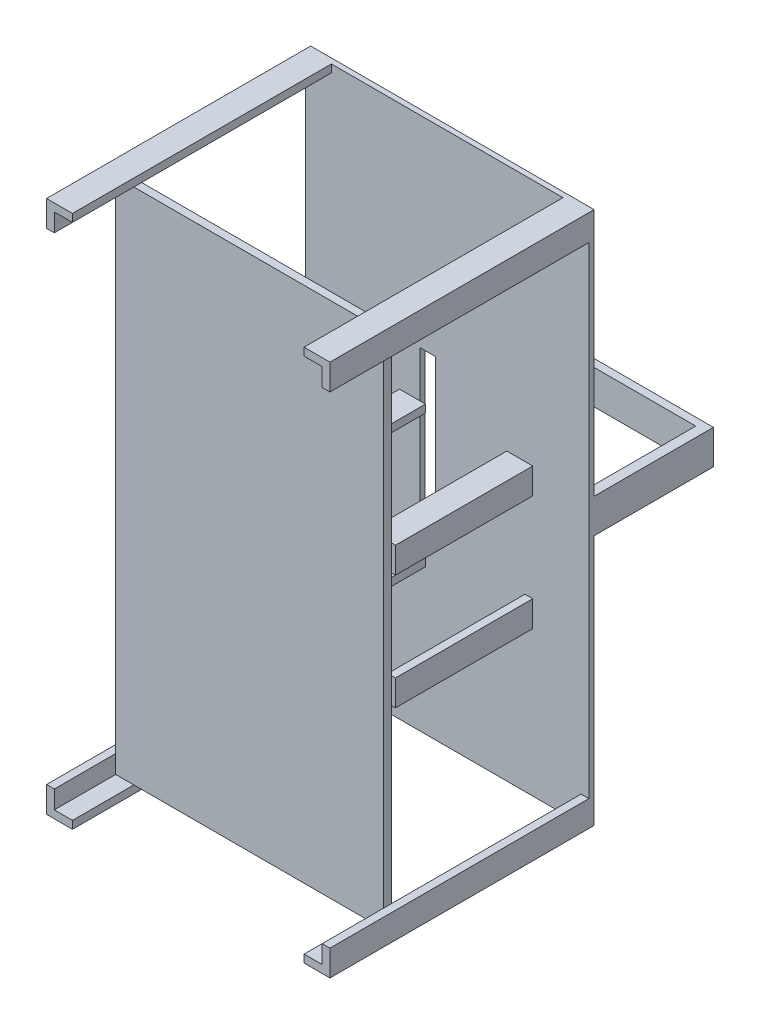
from build123d import *

# Parameters (mm, degrees)
SKETCH1_W             = 1500
SKETCH1_H             = 1500
BOSS_EXTRUDE1_DEPTH   = 20
SKETCH2_W             = 60
SKETCH2_H             = 550
CUT_EXTRUDE1_DEPTH    = 50
CUT_EXTRUDE2_DEPTH    = 2000.909849413
SKETCH4_W             = 1094.415961308
SKETCH4_H             = 600
BOSS_EXTRUDE2_DEPTH   = 20
BOSS_EXTRUDE3_DEPTH   = 1000
SKETCH6_W             = 1034.415961308
SKETCH6_H             = 1999.906293538
BOSS_EXTRUDE4_DEPTH   = 30
BOSS_EXTRUDE5_DEPTH   = 530
BOSS_EXTRUDE5_2_DEPTH = 530
BOSS_EXTRUDE5_3_DEPTH = 530
BOSS_EXTRUDE5_4_DEPTH = 530
SKETCH9_W             = 38.38274209
SKETCH9_H             = 132.105402432
BOSS_EXTRUDE6_DEPTH   = 461
BOSS_EXTRUDE7_DEPTH   = 30
SKETCH11_R            = 22.381871054
BOSS_EXTRUDE8_DEPTH   = 50
BOSS_EXTRUDE8_2_DEPTH = 50
FILLET1_R             = 20
FILLET2_R             = 20


with BuildPart() as part:
    # Sketch1 → Boss-Extrude1 (new body)
    with BuildSketch(Plane.XY):
        with Locations((-647.933366328, 680.042554992)):
            Rectangle(SKETCH1_W, SKETCH1_H)
    extrude(amount=BOSS_EXTRUDE1_DEPTH)

    # Sketch2 → Cut-Extrude1 (cut)
    with BuildSketch(Plane(origin=(0, 0, 0), x_dir=(-1, 0, 0), z_dir=(0, 0, -1))):
        with Locations((926.595771641, 727.237288333)):
            Rectangle(SKETCH2_W, SKETCH2_H)
    extrude(amount=-CUT_EXTRUDE1_DEPTH, mode=Mode.SUBTRACT)

    # Sketch3 → Cut-Extrude2 (cut, through all)
    with BuildSketch(Plane.XY.offset(20)):
        Polygon((-1397.933366328, 1180.031353787), (-303.51740502, 1180.031353787), (-303.51740502, 320.125060249), (-1397.933366328, 320.125060249), (-2007.945142602, 196.828102761), (-1938.57438465, -209.936796138), (-1019.34429441, -263.492739842), (191.211340308, -395.978442354), (1017.298661853, -131.007037329), (397.03562433, 795.178187448), (264.742348401, 1570.89785085), (-1070.217072335, 1498.737882161), (-1589.868105208, 1438.824408359), (-1644.490156481, 1252.191322475), align=None)
    extrude(amount=-CUT_EXTRUDE2_DEPTH, mode=Mode.SUBTRACT)

    # Sketch4 → Boss-Extrude2 (add)
    with BuildSketch(Plane(origin=(0, 0, 0), x_dir=(-1, 0, 0), z_dir=(0, 0, -1))):
        with Locations((850.725385674, 1480.031353787)):
            Rectangle(SKETCH4_W, SKETCH4_H)
        with Locations((850.725385674, 20.125060249)):
            Rectangle(SKETCH4_W, SKETCH4_H)
    extrude(amount=-BOSS_EXTRUDE2_DEPTH)

    # Sketch5 → Boss-Extrude3 (add)
    with BuildSketch(Plane.XY.offset(20)):
        Polygon((-1397.933366328, 1780.031353787), (-1297.933366328, 1780.031353787), (-1297.933366328, 1750.031353787), (-1367.933366328, 1750.031353787), (-1367.933366328, 1680.031353787), (-1397.933366328, 1680.031353787), align=None)
        Polygon((-303.51740502, 1780.031353787), (-403.51740502, 1780.031353787), (-403.51740502, 1750.031353787), (-333.51740502, 1750.031353787), (-333.51740502, 1680.031353787), (-303.51740502, 1680.031353787), align=None)
        Polygon((-1397.933366328, -179.874939751), (-1397.933366328, -279.874939751), (-1297.933366328, -279.874939751), (-1297.933366328, -249.874939751), (-1367.933366328, -249.874939751), (-1367.933366328, -179.874939751), align=None)
        Polygon((-303.51740502, -279.874939751), (-303.51740502, -179.874939751), (-333.51740502, -179.874939751), (-333.51740502, -249.874939751), (-403.51740502, -249.874939751), (-403.51740502, -279.874939751), align=None)
    extrude(amount=BOSS_EXTRUDE3_DEPTH)

    # Sketch6 → Boss-Extrude4 (add)
    with BuildSketch(Plane.XY.offset(753)):
        with Locations((-850.725385674, 750.078207018)):
            Rectangle(SKETCH6_W, SKETCH6_H)
    extrude(amount=BOSS_EXTRUDE4_DEPTH)

    # Sketch9 → Boss-Extrude6 (add)
    with BuildSketch(Plane(origin=(0, 0, 0), x_dir=(-1, 0, 0), z_dir=(0, 0, -1))):
        with Locations((322.708776065, 755.294441101)):
            Rectangle(SKETCH9_W, SKETCH9_H)
    extrude(amount=BOSS_EXTRUDE6_DEPTH)

    # Sketch10 → Boss-Extrude7 (add)
    with BuildSketch(Plane(origin=(0, 0, -461), x_dir=(-1, 0, 0), z_dir=(0, 0, -1))):
        Polygon((303.51740502, 821.347142317), (896.595771641, 821.347142317), (896.595771641, 906.386015183), (956.595771641, 906.386015183), (956.595771641, 617.278895192), (896.595771641, 617.278895192), (896.595771641, 689.241739885), (303.51740502, 689.241739885), align=None)
    extrude(amount=-BOSS_EXTRUDE7_DEPTH)


with BuildPart() as body_2:
    # Sketch8 → Boss-Extrude5 (new body)
    with BuildSketch(Plane(origin=(0, 0, 753), x_dir=(-1, 0, 0), z_dir=(0, 0, -1))):
        Polygon((346.609702996, 992.92220544), (417.482318412, 997.02649787), (417.482318412, 1027.02649787), (317.482318412, 1027.02649787), (317.482318412, 927.02649787), (347.482318412, 927.02649787), align=None)
    extrude(amount=BOSS_EXTRUDE5_DEPTH)


with BuildPart() as body_3:
    # Sketch8 → Boss-Extrude5 2 (new body)
    with BuildSketch(Plane(origin=(0, 0, 753), x_dir=(-1, 0, 0), z_dir=(0, 0, -1))):
        Polygon((731.532784981, 997.02649787), (731.532784981, 1027.02649787), (831.532784981, 1027.02649787), (831.532784981, 927.02649787), (801.532784981, 927.02649787), (801.532784981, 997.02649787), align=None)
    extrude(amount=BOSS_EXTRUDE5_2_DEPTH)


with BuildPart() as body_4:
    # Sketch8 → Boss-Extrude5 3 (new body)
    with BuildSketch(Plane(origin=(0, 0, 753), x_dir=(-1, 0, 0), z_dir=(0, 0, -1))):
        Polygon((801.532784981, 583.10572659), (831.532784981, 583.10572659), (831.532784981, 483.10572659), (731.532784981, 483.10572659), (731.532784981, 513.10572659), (801.532784981, 513.10572659), align=None)
    extrude(amount=BOSS_EXTRUDE5_3_DEPTH)


with BuildPart() as body_5:
    # Sketch8 → Boss-Extrude5 4 (new body)
    with BuildSketch(Plane(origin=(0, 0, 753), x_dir=(-1, 0, 0), z_dir=(0, 0, -1))):
        Polygon((347.482318412, 513.10572659), (347.482318412, 583.10572659), (317.482318412, 583.10572659), (317.482318412, 483.10572659), (417.482318412, 483.10572659), (417.482318412, 513.10572659), align=None)
    extrude(amount=BOSS_EXTRUDE5_4_DEPTH)


with BuildPart() as body_6:
    # Sketch11 → Boss-Extrude8 (new body)
    with BuildSketch(Plane(origin=(0, 0, -461), x_dir=(-1, 0, 0), z_dir=(0, 0, -1))):
        with Locations((978.977642694, 862.69149813)):
            Circle(SKETCH11_R)
    extrude(amount=-BOSS_EXTRUDE8_DEPTH)

    # Fillet1
    fillet1_edges = [body_6.edges().sort_by_distance(p)[0] for p in [
        (-956.595771641, 862.69149813, -411),
    ]]
    fillet(fillet1_edges, radius=FILLET1_R)


with BuildPart() as body_7:
    # Sketch11 → Boss-Extrude8 2 (new body)
    with BuildSketch(Plane(origin=(0, 0, -461), x_dir=(-1, 0, 0), z_dir=(0, 0, -1))):
        with Locations((978.977642694, 663.223285972)):
            Circle(SKETCH11_R)
    extrude(amount=-BOSS_EXTRUDE8_2_DEPTH)

    # Fillet2
    fillet2_edges = [body_7.edges().sort_by_distance(p)[0] for p in [
        (-956.595771641, 663.223285972, -411),
    ]]
    fillet(fillet2_edges, radius=FILLET2_R)


solid = Compound([part.part, body_2.part, body_3.part, body_4.part, body_5.part, body_6.part, body_7.part])
